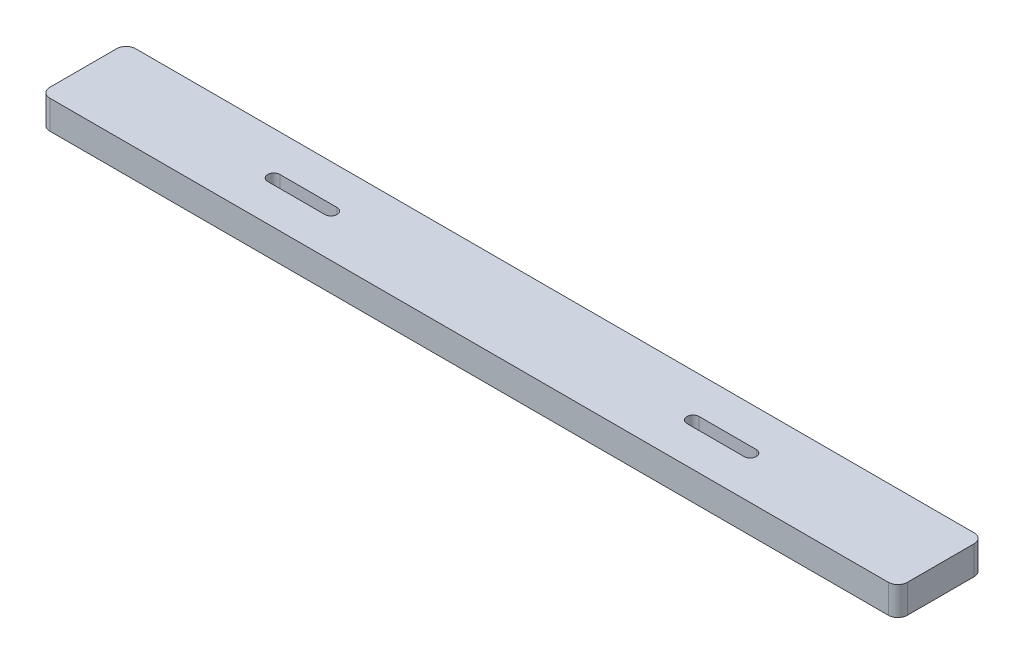
from build123d import *

# Parameters (mm, degrees)
SKETCH1_W           = 571.5
SKETCH1_H           = 57.15
BOSS_EXTRUDE1_DEPTH = 19.05
FILLET1_R           = 6.35
CUT_EXTRUDE1_DEPTH  = 19.05


with BuildPart() as part:
    # Sketch1 → Boss-Extrude1 (new body)
    with BuildSketch(Plane(origin=(0, 0, 0), x_dir=(1, 0, 0), z_dir=(0, 1, 0))):
        Rectangle(SKETCH1_W, SKETCH1_H)
    extrude(amount=BOSS_EXTRUDE1_DEPTH)

    # Fillet1
    fillet1_edges = [part.edges().sort_by_distance(p)[0] for p in [
        (-285.75, 9.525, -28.575),
        (285.75, 9.525, -28.575),
        (285.75, 9.525, 28.575),
        (-285.75, 9.525, 28.575),
    ]]
    fillet(fillet1_edges, radius=FILLET1_R)

    # Sketch2 → Cut-Extrude1 (cut)
    with BuildSketch(Plane(origin=(0, 19.05, 0), x_dir=(1, 0, 0), z_dir=(0, 1, 0))):
        with BuildLine():
            Line((-120.65, -4.064), (-158.75, -4.064))
            ThreePointArc((-158.75, -4.064), (-162.814, 0), (-158.75, 4.064))
            Line((-158.75, 4.064), (-120.65, 4.064))
            ThreePointArc((-120.65, 4.064), (-116.586, 0), (-120.65, -4.064))
        make_face()
        with BuildLine():
            Line((120.65, -4.064), (158.75, -4.064))
            ThreePointArc((158.75, -4.064), (162.814, 0), (158.75, 4.064))
            Line((158.75, 4.064), (120.65, 4.064))
            ThreePointArc((120.65, 4.064), (116.586, 0), (120.65, -4.064))
        make_face()
    extrude(amount=-CUT_EXTRUDE1_DEPTH, mode=Mode.SUBTRACT)


solid = part.part
